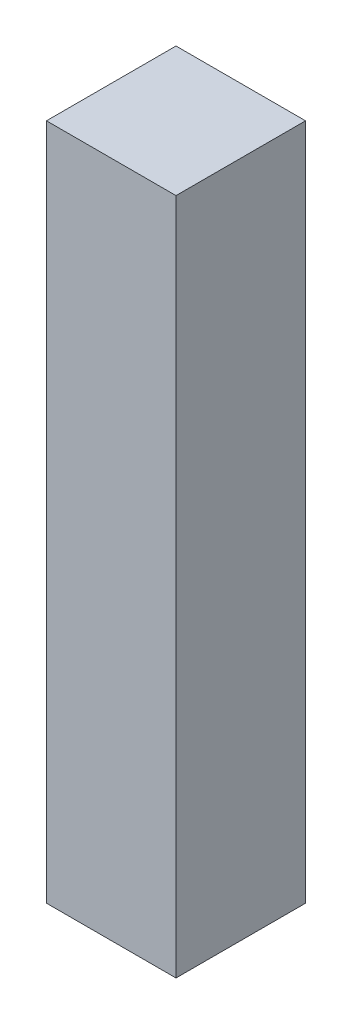
from build123d import *

# Parameters (mm, degrees)
SKETCH1_W           = 82.55
SKETCH1_H           = 82.55
BOSS_EXTRUDE1_DEPTH = 431.8


with BuildPart() as part:
    # Sketch1 → Boss-Extrude1 (new body)
    with BuildSketch(Plane(origin=(0, 0, 0), x_dir=(1, 0, 0), z_dir=(0, 1, 0))):
        Rectangle(SKETCH1_W, SKETCH1_H)
    extrude(amount=BOSS_EXTRUDE1_DEPTH)


solid = part.part
